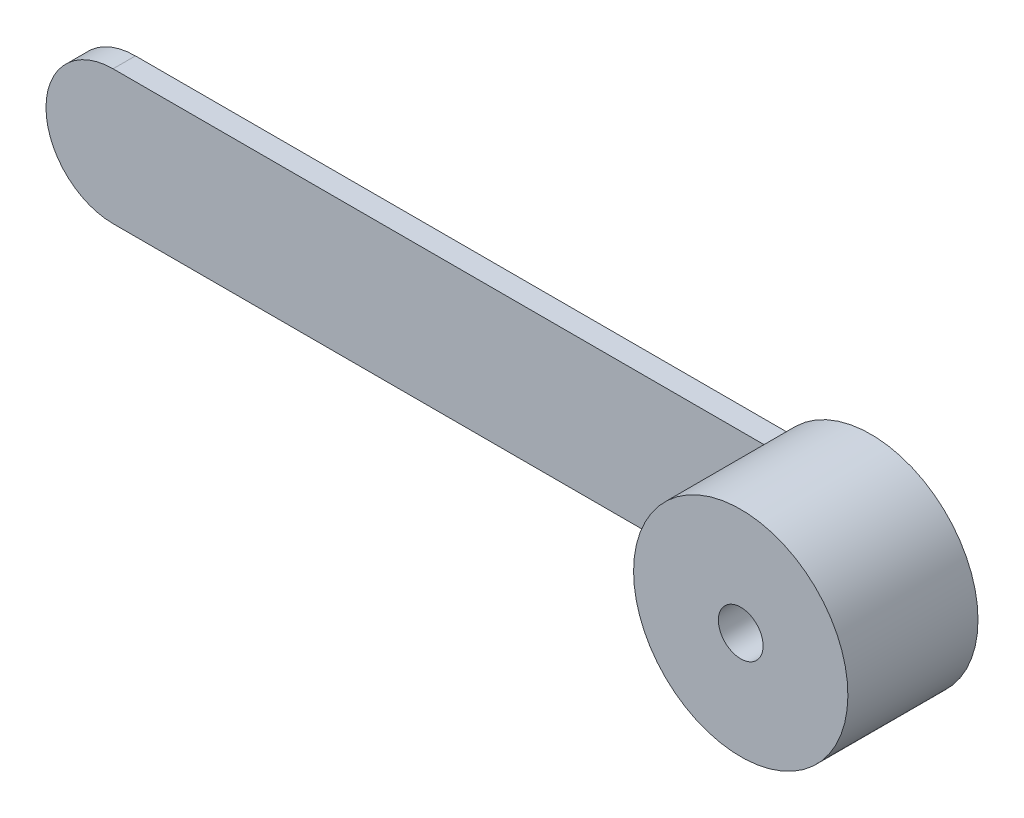
from build123d import *

# Parameters (mm, degrees)
SKETCH1_W           = 50
SKETCH1_H           = 50
BOSS_EXTRUDE1_DEPTH = 50
SKETCH2_W           = 50
SKETCH2_H           = 30
CUT_EXTRUDE1_DEPTH  = 5
SKETCH3_W           = 5
SKETCH3_H           = 30
BOSS_EXTRUDE2_DEPTH = 150
SKETCH4_R           = 35
BOSS_EXTRUDE3_DEPTH = 50
SKETCH5_OUTSIDE_W   = 287.05
SKETCH5_OUTSIDE_H   = 122.05
CUT_EXTRUDE2_DEPTH  = 60
SKETCH6_OUTSIDE_W   = 262.676
SKETCH6_OUTSIDE_H   = 98.214
CUT_EXTRUDE3_DEPTH  = 60
SKETCH7_R           = 5
CUT_EXTRUDE4_DEPTH  = 60
SKETCH8_OUTSIDE_W   = 262.676
SKETCH8_OUTSIDE_H   = 118.214
SKETCH8_OUTSIDE_R   = 23.965206127
CUT_EXTRUDE5_DEPTH  = 45
SKETCH9_OUTSIDE_W   = 262.676
SKETCH9_OUTSIDE_H   = 118.214
CUT_EXTRUDE6_DEPTH  = 47
CUT_EXTRUDE7_DEPTH  = 48.5


with BuildPart() as part:
    # Sketch1 → Boss-Extrude1 (new body)
    with BuildSketch(Plane.XY):
        with Locations((25, 25)):
            Rectangle(SKETCH1_W, SKETCH1_H)
    extrude(amount=BOSS_EXTRUDE1_DEPTH)

    # Sketch2 → Cut-Extrude1 (cut)
    with BuildSketch(Plane.XY.offset(50)):
        with Locations((25, 25)):
            Rectangle(SKETCH2_W, SKETCH2_H)
    extrude(amount=-CUT_EXTRUDE1_DEPTH, mode=Mode.SUBTRACT)

    # Sketch3 → Boss-Extrude2 (add)
    with BuildSketch(Plane(origin=(50, 0, 0), x_dir=(0, 0, -1), z_dir=(1, 0, 0))):
        with Locations((-2.5, 25)):
            Rectangle(SKETCH3_W, SKETCH3_H)
    extrude(amount=BOSS_EXTRUDE2_DEPTH)

    # Sketch4 → Boss-Extrude3 (add)
    with BuildSketch(Plane(origin=(0, 0, 0), x_dir=(-1, 0, 0), z_dir=(0, 0, -1))):
        with Locations((-200, 25)):
            Circle(SKETCH4_R)
    extrude(amount=-BOSS_EXTRUDE3_DEPTH)

    # Sketch5 outside → Cut-Extrude2 (cut)
    with BuildSketch(Plane(origin=(0, 0, 0), x_dir=(-1, 0, 0), z_dir=(0, 0, -1))):
        with Locations((-117.5, 25)):
            Rectangle(SKETCH5_OUTSIDE_W, SKETCH5_OUTSIDE_H)
        with BuildLine():
            Line((-50, 40), (-35.53775066, 40))
            ThreePointArc((-35.53775066, 40), (-20.53775066, 25), (-35.53775066, 10))
            Line((-35.53775066, 10), (-50, 10))
            Line((-50, 10), (-247.49593965, -30.086255952))
            Line((-247.49593965, -30.086255952), (-247.49593965, 85.804552417))
            Line((-247.49593965, 85.804552417), (-50, 40))
        make_face(mode=Mode.SUBTRACT)
    extrude(amount=-CUT_EXTRUDE2_DEPTH, mode=Mode.SUBTRACT)

    # Sketch6 outside → Cut-Extrude3 (cut)
    with BuildSketch(Plane(origin=(0, 40, 0), x_dir=(1, 0, 0), z_dir=(0, 1, 0))):
        with Locations((127.769, -25)):
            Rectangle(SKETCH6_OUTSIDE_W, SKETCH6_OUTSIDE_H)
        Polygon((50, -5), (20.53775066, -5), (20.53775066, 0), (245.971060593, 0), (245.971060593, -81.039305363), (133.254405627, -81.039305363), align=None, mode=Mode.SUBTRACT)
    extrude(amount=-CUT_EXTRUDE3_DEPTH, mode=Mode.SUBTRACT)

    # Sketch7 → Cut-Extrude4 (cut)
    with BuildSketch(Plane.XY.offset(50)):
        with Locations((200, 25)):
            Circle(SKETCH7_R)
    extrude(amount=-CUT_EXTRUDE4_DEPTH, mode=Mode.SUBTRACT)

    # Sketch8 outside → Cut-Extrude5 (cut)
    with BuildSketch(Plane.XY.offset(50)):
        with Locations((127.769, 25)):
            Rectangle(SKETCH8_OUTSIDE_W, SKETCH8_OUTSIDE_H)
        with Locations((200, 25)):
            Circle(SKETCH8_OUTSIDE_R, mode=Mode.SUBTRACT)
    extrude(amount=-CUT_EXTRUDE5_DEPTH, mode=Mode.SUBTRACT)

    # Sketch9 outside → Cut-Extrude6 (cut)
    with BuildSketch(Plane.XY.offset(5)):
        with Locations((127.769, 25)):
            Rectangle(SKETCH9_OUTSIDE_W, SKETCH9_OUTSIDE_H)
        with BuildLine():
            Line((168.377223398, 40), (181.309598594, 40))
            ThreePointArc((181.309598594, 40), (223.965206127, 25), (181.309598594, 10))
            Line((181.309598594, 10), (168.377223398, 10))
            Line((168.377223398, 10), (164.401061703, 1.034793873))
            Line((164.401061703, 1.034793873), (16.874562841, 1.034793873))
            Line((16.874562841, 1.034793873), (16.874562841, 40))
            Line((16.874562841, 40), (168.377223398, 40))
        make_face(mode=Mode.SUBTRACT)
    extrude(amount=-CUT_EXTRUDE6_DEPTH, mode=Mode.SUBTRACT)

    # Sketch10 → Cut-Extrude7 (cut, symmetric)
    with BuildSketch(Plane(origin=(0, 40, 0), x_dir=(1, 0, 0), z_dir=(0, 1, 0))):
        Polygon((232.409731391, -29.094811743), (165.185777122, -29.094811743), (165.185777122, -67.022723685), (235.548593069, -67.022723685), align=None)
    extrude(amount=CUT_EXTRUDE7_DEPTH, both=True, mode=Mode.SUBTRACT)


solid = part.part
